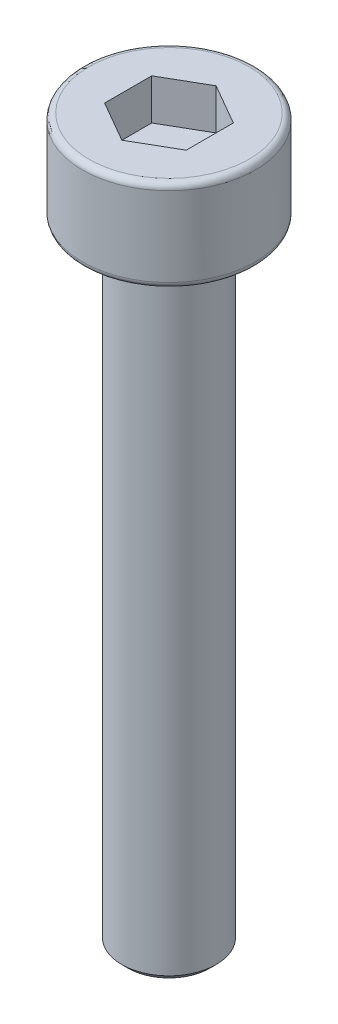
from build123d import *

# Parameters (mm, degrees)
CUT_EXTRUDE_1_DEPTH = 1.3
FILLET_1_R          = 0.2
CHAMFER_1_SIZE      = 0.2


with BuildPart() as part:
    # 草图1 → 旋转1 (revolve)
    with BuildSketch(Plane.XY, mode=Mode.PRIVATE) as revolve_1_sk:
        Polygon((0, 0), (2.75, 0), (2.75, -2.93), (1.5, -2.93), (1.5, -22.93), (0, -22.93), align=None)
    revolve(revolve_1_sk.sketch.rotate(Axis((0, 0, 0), (0, -1, 0)), 90), axis=Axis((0, 0, 0), (0, -1, 0)))

    # 草图2 → 切除-拉伸1 (cut)
    with BuildSketch(Plane(origin=(0, 0, 0), x_dir=(1, 0, 0), z_dir=(0, 1, 0))):
        Polygon((0, 1.5), (-1.299038106, 0.75), (-1.299038106, -0.75), (0, -1.5), (1.299038106, -0.75), (1.299038106, 0.75), align=None)
    extrude(amount=-CUT_EXTRUDE_1_DEPTH, mode=Mode.SUBTRACT)

    # 圆角1
    fillet_1_edges = [part.edges().sort_by_distance(p)[0] for p in [
        (0, -2.93, -2.75),
        (0, 0, -2.75),
    ]]
    fillet(fillet_1_edges, radius=FILLET_1_R)

    # 倒角1
    chamfer_1_edges = [part.edges().sort_by_distance(p)[0] for p in [
        (0, -22.93, -1.5),
    ]]
    chamfer(chamfer_1_edges, length=CHAMFER_1_SIZE)


solid = part.part
